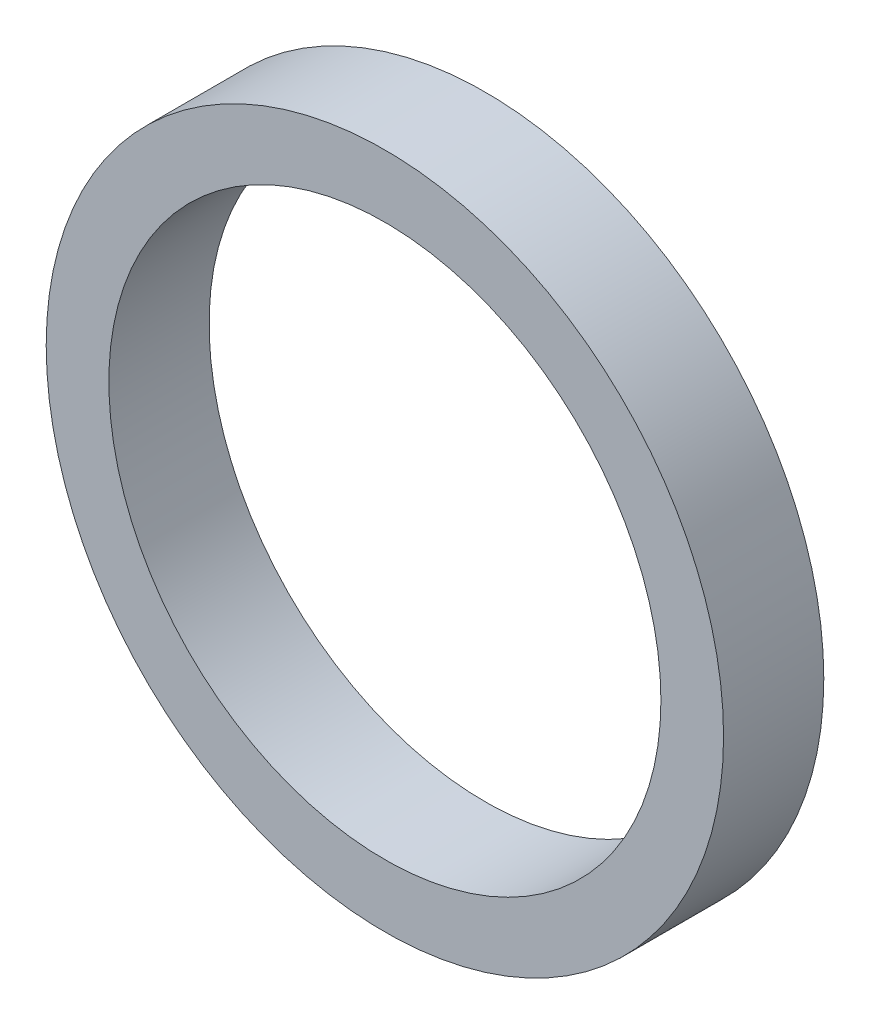
from build123d import *

# Parameters (mm, degrees)
SKETCH3_R           = 13.515
SKETCH3_R_2         = 11.015
BOSS_EXTRUDE3_DEPTH = 4


with BuildPart() as part:
    # Sketch3 → Boss-Extrude3 (new body)
    with BuildSketch(Plane.XY):
        Circle(SKETCH3_R)
        Circle(SKETCH3_R_2, mode=Mode.SUBTRACT)
    extrude(amount=BOSS_EXTRUDE3_DEPTH)


solid = part.part
